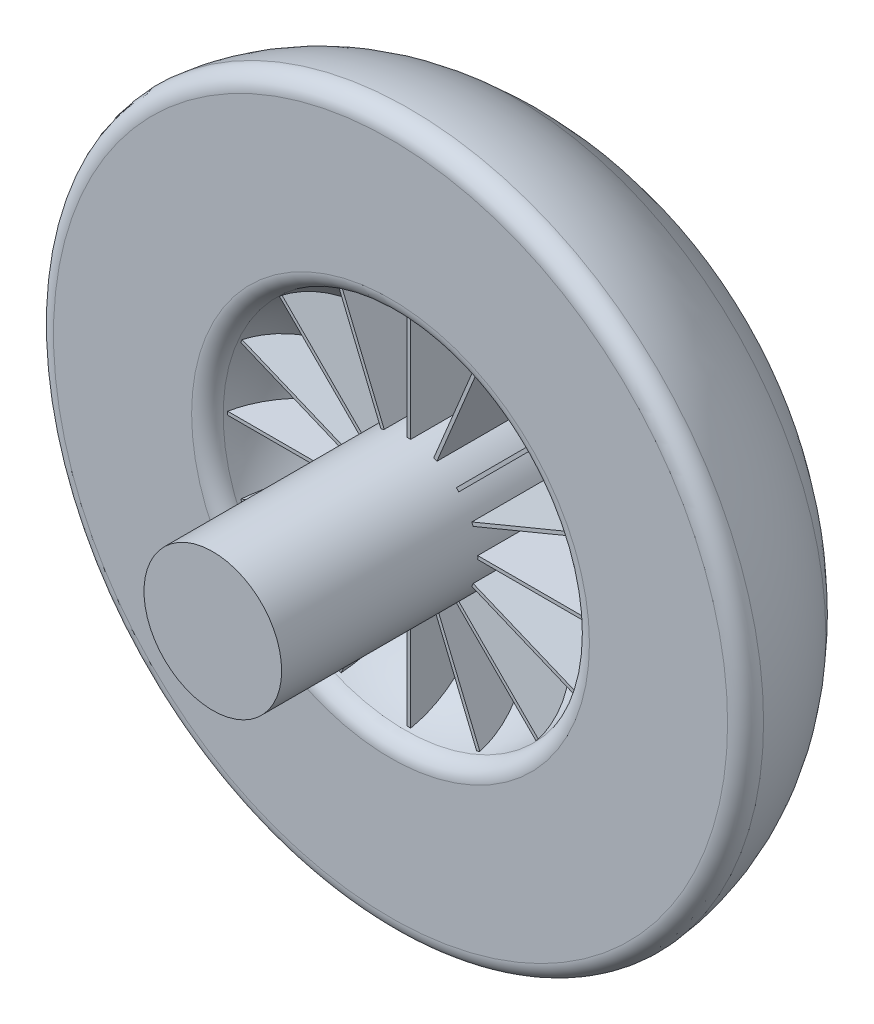
from build123d import *

# Parameters (mm, degrees)
FILLET1_R           = 5
SKETCH2_W           = 22
SKETCH2_H           = 65
BOSS_EXTRUDE1_DEPTH = 0.5
CIRPATTERN1_COUNT   = 16


with BuildPart() as part:
    # Sketch1 → Revolve1 (revolve)
    with BuildSketch(Plane(origin=(0, 0, 0), x_dir=(1, 0, 0), z_dir=(0, 1, 0))):
        with BuildLine():
            Line((0, 40), (24, 40))
            ThreePointArc((24, 40), (60.324810024, 31.951960699), (89.850934031, 9.314143645))
            ThreePointArc((89.850934031, 9.314143645), (99.762932779, -7.838417726), (103.205547522, -27.347556213))
            Line((103.205547522, -27.347556213), (53.205547522, -27.347556213))
            ThreePointArc((53.205547522, -27.347556213), (45.770366553, -8.581469752), (27.5, 0))
            Line((27.5, 0), (20, 0))
            Line((20, 0), (20, -79))
            Line((20, -79), (0, -79))
            Line((0, -79), (0, 0))
            Line((0, 0), (0, 40))
        make_face()
    revolve(axis=Axis((0, 0, 1001.265849516), (0, 0, -1)))

    # Fillet1
    fillet1_edges = [part.edges().sort_by_distance(p)[0] for p in [
        (-53.205547522, 0, 27.347556213),
        (-103.205547522, 0, 27.347556213),
    ]]
    fillet(fillet1_edges, radius=FILLET1_R)

    # Sketch2 → Boss-Extrude1 (add, symmetric)
    with BuildSketch(Plane(origin=(0, 0, 0), x_dir=(0, 0, -1), z_dir=(1, 0, 0))):
        with Locations((-11, -32.5)):
            Rectangle(SKETCH2_W, SKETCH2_H)
    boss_extrude1 = extrude(amount=BOSS_EXTRUDE1_DEPTH, both=True)

    # CirPattern1: Boss-Extrude1 ×16 about axis
    cirpattern1_axis = Axis((0, 0, 0), (0, 0, 1))
    for i in range(1, CIRPATTERN1_COUNT):
        add(boss_extrude1.rotate(cirpattern1_axis, i * 360 / CIRPATTERN1_COUNT))


solid = part.part
